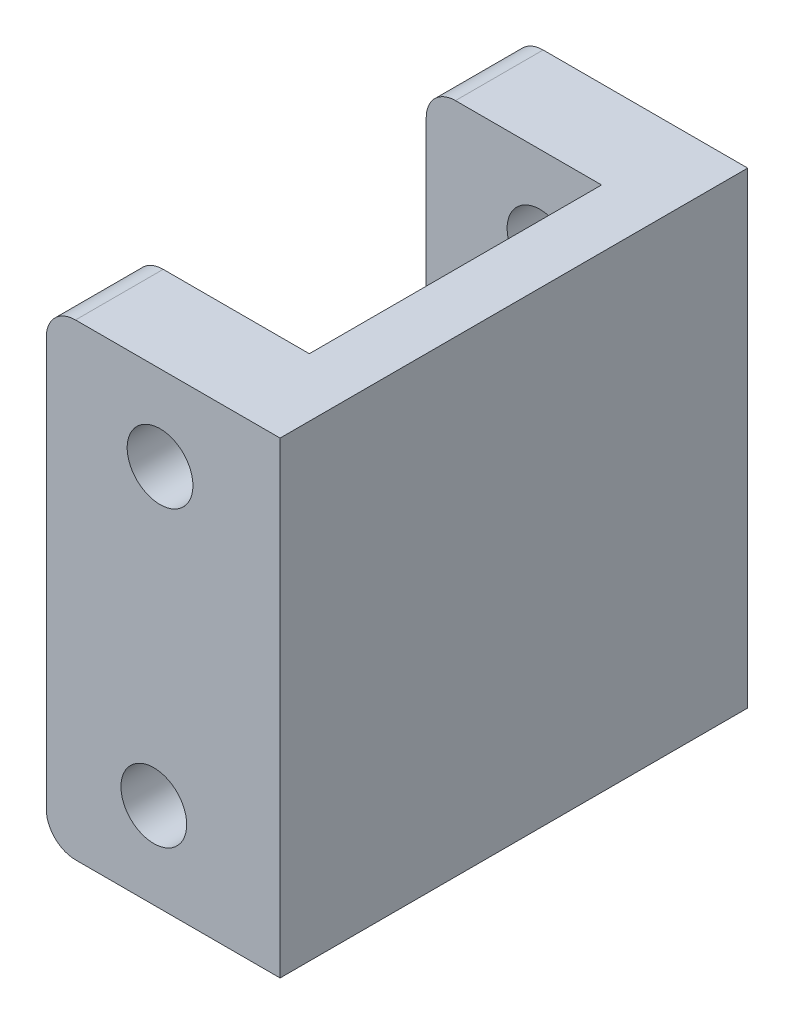
from build123d import *

# Parameters (mm, degrees)
SKETCH1_W               = 25.4
SKETCH1_H               = 50.8
BOSS_EXTRUDE1_DEPTH     = 3.175
SKETCH4_W               = 6.35
SKETCH4_H               = 50.8
BOSS_EXTRUDE2_DEPTH     = 12.7
SKETCH5_W               = 9.525
SKETCH5_H               = 50.8
BOSS_EXTRUDE3_DEPTH     = 25.4
F_1_4_CLEARANCE_HOLE1_D = 7.14248
FILLET1_R               = 3.175


with BuildPart() as part:
    # Sketch1 → Boss-Extrude1 (new, symmetric)
    with BuildSketch(Plane(origin=(0, 0, 0), x_dir=(0, 0, -1), z_dir=(1, 0, 0))):
        Rectangle(SKETCH1_W, SKETCH1_H)
    extrude(amount=BOSS_EXTRUDE1_DEPTH, both=True)

    # Sketch4 → Boss-Extrude2 (add)
    with BuildSketch(Plane.XY.offset(12.7)):
        Rectangle(SKETCH4_W, SKETCH4_H)
    boss_extrude2 = extrude(amount=BOSS_EXTRUDE2_DEPTH)

    # Sketch5 → Boss-Extrude3 (add)
    with BuildSketch(Plane(origin=(3.175, 0, 0), x_dir=(0, 0, -1), z_dir=(1, 0, 0))):
        with Locations((-20.6375, 0)):
            Rectangle(SKETCH5_W, SKETCH5_H)
    boss_extrude3 = extrude(amount=-BOSS_EXTRUDE3_DEPTH)

    # Mirror1: Boss-Extrude2, Boss-Extrude3 across plane
    add(boss_extrude2.mirror(Plane.XY))
    add(boss_extrude3.mirror(Plane.XY))

    # 1/4 Clearance Hole1 (through all)
    with Locations(Plane(origin=(-9.866844114, 16.191031899, 25.4), x_dir=(1, 0, 0), z_dir=(0, 0, 1))):
        with Locations((0, 0), (-0.677264826, -32.232776497)):
            Hole(F_1_4_CLEARANCE_HOLE1_D / 2)

    # Fillet1
    fillet1_edges = [part.edges().sort_by_distance(p)[0] for p in [
        (-22.225, 25.4, 20.6375),
        (-22.225, -25.4, 20.6375),
        (-22.225, -25.4, -20.6375),
        (-22.225, 25.4, -20.6375),
    ]]
    fillet(fillet1_edges, radius=FILLET1_R)


solid = part.part
